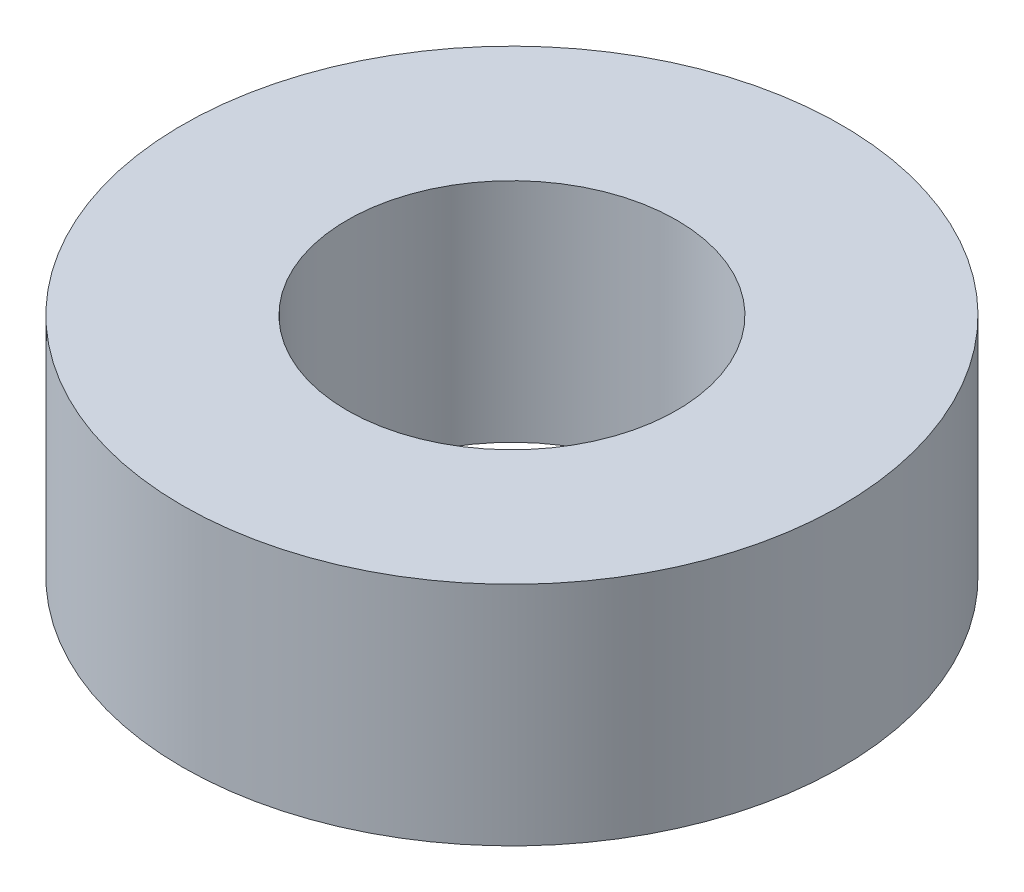
from build123d import *

# Parameters (mm, degrees)
SKETCH1_R           = 4.064
SKETCH1_R_2         = 2.032
BOSS_EXTRUDE1_DEPTH = 2.794


with BuildPart() as part:
    # Sketch1 → Boss-Extrude1 (new body)
    with BuildSketch(Plane(origin=(0, 0, 0), x_dir=(1, 0, 0), z_dir=(0, 1, 0))):
        with Locations(Location((0, 0, 0), (0, 0, 270))):
            Circle(SKETCH1_R)
        with Locations(Location((0, 0, 0), (0, 0, 270))):
            Circle(SKETCH1_R_2, mode=Mode.SUBTRACT)
    extrude(amount=BOSS_EXTRUDE1_DEPTH)


solid = part.part
